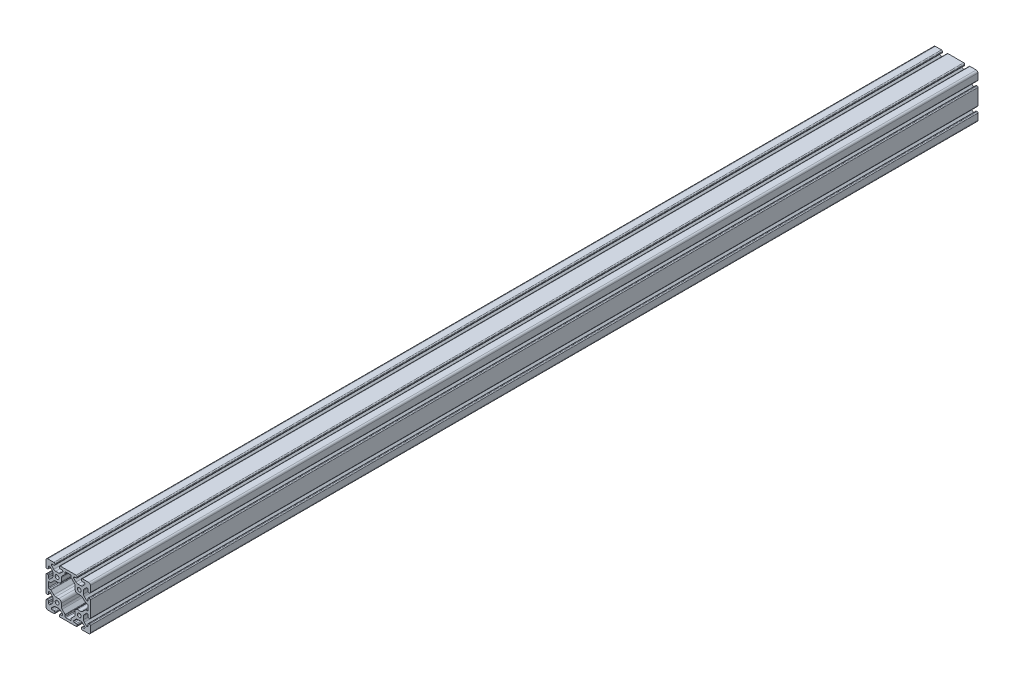
from build123d import *

# Parameters (mm, degrees)
SKETCH1_R      = 3.4
EXTRUDE1_DEPTH = 1600


with BuildPart() as part:
    # Sketch1 → Extrude1 (new body)
    with BuildSketch(Plane.XY):
        with BuildLine():
            Line((29.091242789, 26.036541495), (33.082657296, 30.027956002))
            ThreePointArc((33.082657296, 30.027956002), (33.329219041, 30.192703293), (33.62005845, 30.250554848))
            Line((33.62005845, 30.250554848), (33.955571436, 30.250554848))
            ThreePointArc((33.955571436, 30.250554848), (35.065729082, 29.790712494), (35.525571436, 28.680554848))
            Line((35.525571436, 28.680554848), (35.525571436, 25.777866899))
            ThreePointArc((35.525571436, 25.777866899), (35.985413789, 24.667709253), (37.095571436, 24.207866899))
            Line((37.095571436, 24.207866899), (38.43, 24.207866899))
            ThreePointArc((38.43, 24.207866899), (39.540157646, 24.667709253), (40, 25.777866899))
            Line((40, 25.777866899), (40, 32.933852749))
            Line((40, 32.933852749), (40, 36.83))
            ThreePointArc((40, 36.83), (39.071528496, 39.071528496), (36.83, 40))
            Line((36.83, 40), (25.540851266, 40))
            ThreePointArc((25.540851266, 40), (24.43069362, 39.540157646), (23.970851266, 38.43))
            Line((23.970851266, 38.43), (23.970851266, 37.249043598))
            ThreePointArc((23.970851266, 37.249043598), (24.43069362, 36.138885952), (25.540851266, 35.679043598))
            Line((25.540851266, 35.679043598), (28.625762638, 35.679043598))
            ThreePointArc((28.625762638, 35.679043598), (29.77116849, 35.239363487), (30.250554848, 34.11))
            Line((30.250554848, 34.11), (30.250554848, 33.62005845))
            ThreePointArc((30.250554848, 33.62005845), (30.192703293, 33.329219041), (30.027956002, 33.082657296))
            Line((30.027956002, 33.082657296), (26.036541495, 29.091242789))
            ThreePointArc((26.036541495, 29.091242789), (24.495530588, 28.061572221), (22.677784284, 27.7))
            Line((22.677784284, 27.7), (17.322215716, 27.7))
            ThreePointArc((17.322215716, 27.7), (15.504469412, 28.061572221), (13.963458505, 29.091242789))
            Line((13.963458505, 29.091242789), (9.90393336, 33.150767934))
            ThreePointArc((9.90393336, 33.150767934), (9.764102181, 33.360040084), (9.715, 33.606893415))
            Line((9.715, 33.606893415), (9.715, 34.096834965))
            ThreePointArc((9.715, 34.096834965), (10.178698303, 35.216301697), (11.298165035, 35.68))
            Line((11.298165035, 35.68), (14.642754087, 35.68))
            ThreePointArc((14.642754087, 35.68), (15.560045469, 36.059954531), (15.94, 36.977245913))
            Line((15.94, 36.977245913), (15.94, 38.194841282))
            ThreePointArc((15.94, 38.194841282), (15.411281253, 39.471281253), (14.134841282, 40))
            Line((14.134841282, 40), (6.984433948, 40))
            Line((6.984433948, 40), (-6.984433948, 40))
            Line((-6.984433948, 40), (-14.134841282, 40))
            ThreePointArc((-14.134841282, 40), (-15.411281253, 39.471281253), (-15.94, 38.194841282))
            Line((-15.94, 38.194841282), (-15.94, 36.977245913))
            ThreePointArc((-15.94, 36.977245913), (-15.560045469, 36.059954531), (-14.642754087, 35.68))
            Line((-14.642754087, 35.68), (-11.298165035, 35.68))
            ThreePointArc((-11.298165035, 35.68), (-10.178698303, 35.216301697), (-9.715, 34.096834965))
            Line((-9.715, 34.096834965), (-9.715, 33.606893415))
            ThreePointArc((-9.715, 33.606893415), (-9.764102181, 33.360040084), (-9.90393336, 33.150767934))
            Line((-9.90393336, 33.150767934), (-13.963458505, 29.091242789))
            ThreePointArc((-13.963458505, 29.091242789), (-15.504469412, 28.061572221), (-17.322215716, 27.7))
            Line((-17.322215716, 27.7), (-22.677784284, 27.7))
            ThreePointArc((-22.677784284, 27.7), (-24.495530588, 28.061572221), (-26.036541495, 29.091242789))
            Line((-26.036541495, 29.091242789), (-30.09606664, 33.150767934))
            ThreePointArc((-30.09606664, 33.150767934), (-30.235897819, 33.360040084), (-30.285, 33.606893415))
            Line((-30.285, 33.606893415), (-30.285, 34.096834965))
            ThreePointArc((-30.285, 34.096834965), (-29.821301697, 35.216301697), (-28.701834965, 35.68))
            Line((-28.701834965, 35.68), (-25.357245913, 35.68))
            ThreePointArc((-25.357245913, 35.68), (-24.439954531, 36.059954531), (-24.06, 36.977245913))
            Line((-24.06, 36.977245913), (-24.06, 38.194841282))
            ThreePointArc((-24.06, 38.194841282), (-24.588718747, 39.471281253), (-25.865158718, 40))
            Line((-25.865158718, 40), (-33.031395847, 40))
            Line((-33.031395847, 40), (-36.83, 40))
            ThreePointArc((-36.83, 40), (-39.071528496, 39.071528496), (-40, 36.83))
            Line((-40, 36.83), (-40, 33.318079463))
            Line((-40, 33.318079463), (-40, 25.865158718))
            ThreePointArc((-40, 25.865158718), (-39.471281253, 24.588718747), (-38.194841282, 24.06))
            Line((-38.194841282, 24.06), (-36.977245913, 24.06))
            ThreePointArc((-36.977245913, 24.06), (-36.059954531, 24.439954531), (-35.68, 25.357245913))
            Line((-35.68, 25.357245913), (-35.68, 28.680554848))
            ThreePointArc((-35.68, 28.680554848), (-35.220157646, 29.790712494), (-34.11, 30.250554848))
            Line((-34.11, 30.250554848), (-33.62005845, 30.250554848))
            ThreePointArc((-33.62005845, 30.250554848), (-33.329219041, 30.192703293), (-33.082657296, 30.027956002))
            Line((-33.082657296, 30.027956002), (-29.091242789, 26.036541495))
            ThreePointArc((-29.091242789, 26.036541495), (-28.061572221, 24.495530588), (-27.7, 22.677784284))
            Line((-27.7, 22.677784284), (-27.7, 17.322215716))
            ThreePointArc((-27.7, 17.322215716), (-28.061572221, 15.504469412), (-29.091242789, 13.963458505))
            Line((-29.091242789, 13.963458505), (-33.082657296, 9.972043998))
            ThreePointArc((-33.082657296, 9.972043998), (-33.329219041, 9.807296707), (-33.62005845, 9.749445152))
            Line((-33.62005845, 9.749445152), (-34.11, 9.749445152))
            ThreePointArc((-34.11, 9.749445152), (-35.220157646, 10.209287506), (-35.68, 11.319445152))
            Line((-35.68, 11.319445152), (-35.68, 14.642754087))
            ThreePointArc((-35.68, 14.642754087), (-36.059954531, 15.560045469), (-36.977245913, 15.94))
            Line((-36.977245913, 15.94), (-38.194841282, 15.94))
            ThreePointArc((-38.194841282, 15.94), (-39.471281253, 15.411281253), (-40, 14.134841282))
            Line((-40, 14.134841282), (-40, 7.016888977))
            Line((-40, 7.016888977), (-40, -7.016888977))
            Line((-40, -7.016888977), (-40, -14.447338303))
            ThreePointArc((-40, -14.447338303), (-39.540157646, -15.557495949), (-38.43, -16.017338303))
            Line((-38.43, -16.017338303), (-37.25, -16.017338303))
            ThreePointArc((-37.25, -16.017338303), (-36.139842354, -15.557495949), (-35.68, -14.447338303))
            Line((-35.68, -14.447338303), (-35.68, -11.319445152))
            ThreePointArc((-35.68, -11.319445152), (-35.220157646, -10.209287506), (-34.11, -9.749445152))
            Line((-34.11, -9.749445152), (-33.62005845, -9.749445152))
            ThreePointArc((-33.62005845, -9.749445152), (-33.329219041, -9.807296707), (-33.082657296, -9.972043998))
            Line((-33.082657296, -9.972043998), (-29.091242789, -13.963458505))
            ThreePointArc((-29.091242789, -13.963458505), (-28.061572221, -15.504469412), (-27.7, -17.322215716))
            Line((-27.7, -17.322215716), (-27.7, -22.677784284))
            ThreePointArc((-27.7, -22.677784284), (-28.061572221, -24.495530588), (-29.091242789, -26.036541495))
            Line((-29.091242789, -26.036541495), (-32.871776968, -29.817075674))
            ThreePointArc((-32.871776968, -29.817075674), (-33.10612883, -29.976640176), (-33.382654504, -30.039211548))
            Line((-33.382654504, -30.039211548), (-34.05520779, -30.062697627))
            ThreePointArc((-34.05520779, -30.062697627), (-35.200613642, -29.623017515), (-35.68, -28.493654028))
            Line((-35.68, -28.493654028), (-35.68, -25.59096608))
            ThreePointArc((-35.68, -25.59096608), (-36.139842354, -24.480808433), (-37.25, -24.02096608))
            Line((-37.25, -24.02096608), (-38.43, -24.02096608))
            ThreePointArc((-38.43, -24.02096608), (-39.540157646, -24.480808433), (-40, -25.59096608))
            Line((-40, -25.59096608), (-40, -33.019082273))
            Line((-40, -33.019082273), (-40, -36.83))
            ThreePointArc((-40, -36.83), (-39.071528496, -39.071528496), (-36.83, -40))
            Line((-36.83, -40), (-33, -40))
            Line((-33, -40), (-25.72307469, -40))
            ThreePointArc((-25.72307469, -40), (-24.612917043, -39.540157646), (-24.15307469, -38.43))
            Line((-24.15307469, -38.43), (-24.15307469, -37.25))
            ThreePointArc((-24.15307469, -37.25), (-24.612917043, -36.139842354), (-25.72307469, -35.68))
            Line((-25.72307469, -35.68), (-28.680554848, -35.68))
            ThreePointArc((-28.680554848, -35.68), (-29.790712494, -35.220157646), (-30.250554848, -34.11))
            Line((-30.250554848, -34.11), (-30.250554848, -33.62005845))
            ThreePointArc((-30.250554848, -33.62005845), (-30.192703293, -33.329219041), (-30.027956002, -33.082657296))
            Line((-30.027956002, -33.082657296), (-26.036541495, -29.091242789))
            ThreePointArc((-26.036541495, -29.091242789), (-24.495530588, -28.061572221), (-22.677784284, -27.7))
            Line((-22.677784284, -27.7), (-17.322215716, -27.7))
            ThreePointArc((-17.322215716, -27.7), (-15.504469412, -28.061572221), (-13.963458505, -29.091242789))
            Line((-13.963458505, -29.091242789), (-10.203784275, -32.85091702))
            ThreePointArc((-10.203784275, -32.85091702), (-10.044219772, -33.085268882), (-9.9816484, -33.361794556))
            Line((-9.9816484, -33.361794556), (-9.957433876, -34.05520779))
            ThreePointArc((-9.957433876, -34.05520779), (-10.397113988, -35.200613642), (-11.526477474, -35.68))
            Line((-11.526477474, -35.68), (-14.429165423, -35.68))
            ThreePointArc((-14.429165423, -35.68), (-15.539323069, -36.139842354), (-15.999165423, -37.25))
            Line((-15.999165423, -37.25), (-15.999165423, -38.43))
            ThreePointArc((-15.999165423, -38.43), (-15.539323069, -39.540157646), (-14.429165423, -40))
            Line((-14.429165423, -40), (-6.998716097, -40))
            Line((-6.998716097, -40), (6.998716097, -40))
            Line((6.998716097, -40), (14.424638994, -40))
            ThreePointArc((14.424638994, -40), (15.53479664, -39.540157646), (15.994638994, -38.43))
            Line((15.994638994, -38.43), (15.994638994, -37.032644306))
            ThreePointArc((15.994638994, -37.032644306), (15.53479664, -35.922486659), (14.424638994, -35.462644306))
            Line((14.424638994, -35.462644306), (11.382372282, -35.462644306))
            ThreePointArc((11.382372282, -35.462644306), (10.272214636, -35.002801952), (9.812372282, -33.892644306))
            Line((9.812372282, -33.892644306), (9.812372282, -33.55713132))
            ThreePointArc((9.812372282, -33.55713132), (9.870223837, -33.266291912), (10.034971128, -33.019730166))
            Line((10.034971128, -33.019730166), (13.963458505, -29.091242789))
            ThreePointArc((13.963458505, -29.091242789), (15.504469412, -28.061572221), (17.322215716, -27.7))
            Line((17.322215716, -27.7), (22.677784284, -27.7))
            ThreePointArc((22.677784284, -27.7), (24.495530588, -28.061572221), (26.036541495, -29.091242789))
            Line((26.036541495, -29.091242789), (29.794925243, -32.849626538))
            ThreePointArc((29.794925243, -32.849626538), (29.954489746, -33.083978399), (30.017061118, -33.360504074))
            Line((30.017061118, -33.360504074), (30.041320706, -34.05520779))
            ThreePointArc((30.041320706, -34.05520779), (29.601640594, -35.200613642), (28.472277108, -35.68))
            Line((28.472277108, -35.68), (25.569589159, -35.68))
            ThreePointArc((25.569589159, -35.68), (24.459431513, -36.139842354), (23.999589159, -37.25))
            Line((23.999589159, -37.25), (23.999589159, -38.43))
            ThreePointArc((23.999589159, -38.43), (24.459431513, -39.540157646), (25.569589159, -40))
            Line((25.569589159, -40), (32.999849358, -40))
            Line((32.999849358, -40), (36.83, -40))
            ThreePointArc((36.83, -40), (39.071528496, -39.071528496), (40, -36.83))
            Line((40, -36.83), (40, -33.025941835))
            Line((40, -33.025941835), (40, -25.777866899))
            ThreePointArc((40, -25.777866899), (39.540157646, -24.667709253), (38.43, -24.207866899))
            Line((38.43, -24.207866899), (37.25, -24.207866899))
            ThreePointArc((37.25, -24.207866899), (36.139842354, -24.667709253), (35.68, -25.777866899))
            Line((35.68, -25.777866899), (35.68, -28.680554848))
            ThreePointArc((35.68, -28.680554848), (35.220157646, -29.790712494), (34.11, -30.250554848))
            Line((34.11, -30.250554848), (33.62005845, -30.250554848))
            ThreePointArc((33.62005845, -30.250554848), (33.329219041, -30.192703293), (33.082657296, -30.027956002))
            Line((33.082657296, -30.027956002), (29.091242789, -26.036541495))
            ThreePointArc((29.091242789, -26.036541495), (28.061572221, -24.495530588), (27.7, -22.677784284))
            Line((27.7, -22.677784284), (27.7, -17.322215716))
            ThreePointArc((27.7, -17.322215716), (28.061572221, -15.504469412), (29.091242789, -13.963458505))
            Line((29.091242789, -13.963458505), (33.082657296, -9.972043998))
            ThreePointArc((33.082657296, -9.972043998), (33.329219041, -9.807296707), (33.62005845, -9.749445152))
            Line((33.62005845, -9.749445152), (34.11, -9.749445152))
            ThreePointArc((34.11, -9.749445152), (35.220157646, -10.209287506), (35.68, -11.319445152))
            Line((35.68, -11.319445152), (35.68, -14.222133101))
            ThreePointArc((35.68, -14.222133101), (36.139842354, -15.332290747), (37.25, -15.792133101))
            Line((37.25, -15.792133101), (38.43, -15.792133101))
            ThreePointArc((38.43, -15.792133101), (39.540157646, -15.332290747), (40, -14.222133101))
            Line((40, -14.222133101), (40, -7.021415406))
            Line((40, -7.021415406), (40, 7.021415406))
            Line((40, 7.021415406), (40, 14.222133101))
            ThreePointArc((40, 14.222133101), (39.540157646, 15.332290747), (38.43, 15.792133101))
            Line((38.43, 15.792133101), (37.25, 15.792133101))
            ThreePointArc((37.25, 15.792133101), (36.139842354, 15.332290747), (35.68, 14.222133101))
            Line((35.68, 14.222133101), (35.68, 11.319445152))
            ThreePointArc((35.68, 11.319445152), (35.220157646, 10.209287506), (34.11, 9.749445152))
            Line((34.11, 9.749445152), (33.62005845, 9.749445152))
            ThreePointArc((33.62005845, 9.749445152), (33.329219041, 9.807296707), (33.082657296, 9.972043998))
            Line((33.082657296, 9.972043998), (29.091242789, 13.963458505))
            ThreePointArc((29.091242789, 13.963458505), (28.061572221, 15.504469412), (27.7, 17.322215716))
            Line((27.7, 17.322215716), (27.7, 22.677784284))
            ThreePointArc((27.7, 22.677784284), (28.061572221, 24.495530588), (29.091242789, 26.036541495))
        make_face()
        with Locations((-20, 20)):
            Circle(SKETCH1_R, mode=Mode.SUBTRACT)
        with Locations((20, 20)):
            Circle(SKETCH1_R, mode=Mode.SUBTRACT)
        with Locations((20, -20)):
            Circle(SKETCH1_R, mode=Mode.SUBTRACT)
        with Locations((-20, -20)):
            Circle(SKETCH1_R, mode=Mode.SUBTRACT)
        with BuildLine():
            Line((17.07, 12.32), (22.657784284, 12.32))
            ThreePointArc((22.657784284, 12.32), (24.475530588, 11.958427779), (26.016541495, 10.928757211))
            Line((26.016541495, 10.928757211), (31.143879165, 5.80141954))
            ThreePointArc((31.143879165, 5.80141954), (31.555896818, 5.526118146), (32.041904777, 5.429445152))
            Line((32.041904777, 5.429445152), (34.41, 5.429445152))
            ThreePointArc((34.41, 5.429445152), (35.308025612, 5.057470764), (35.68, 4.159445152))
            Line((35.68, 4.159445152), (35.68, -4.159445152))
            ThreePointArc((35.68, -4.159445152), (35.308025612, -5.057470764), (34.41, -5.429445152))
            Line((34.41, -5.429445152), (32.041904777, -5.429445152))
            ThreePointArc((32.041904777, -5.429445152), (31.555896818, -5.526118146), (31.143879165, -5.80141954))
            Line((31.143879165, -5.80141954), (26.016541495, -10.928757211))
            ThreePointArc((26.016541495, -10.928757211), (24.475530588, -11.958427779), (22.657784284, -12.32))
            Line((22.657784284, -12.32), (17.07, -12.32))
            ThreePointArc((17.07, -12.32), (13.711242789, -13.711242789), (12.32, -17.07))
            Line((12.32, -17.07), (12.32, -22.657784284))
            ThreePointArc((12.32, -22.657784284), (11.958427779, -24.475530588), (10.928757211, -26.016541495))
            Line((10.928757211, -26.016541495), (5.80141954, -31.143879165))
            ThreePointArc((5.80141954, -31.143879165), (5.526118146, -31.555896818), (5.429445152, -32.041904777))
            Line((5.429445152, -32.041904777), (5.429445152, -34.41))
            ThreePointArc((5.429445152, -34.41), (5.057470764, -35.308025612), (4.159445152, -35.68))
            Line((4.159445152, -35.68), (-4.159445152, -35.68))
            ThreePointArc((-4.159445152, -35.68), (-5.057470764, -35.308025612), (-5.429445152, -34.41))
            Line((-5.429445152, -34.41), (-5.429445152, -32.041904777))
            ThreePointArc((-5.429445152, -32.041904777), (-5.526118146, -31.555896818), (-5.80141954, -31.143879165))
            Line((-5.80141954, -31.143879165), (-10.928757211, -26.016541495))
            ThreePointArc((-10.928757211, -26.016541495), (-11.958427779, -24.475530588), (-12.32, -22.657784284))
            Line((-12.32, -22.657784284), (-12.32, -17.07))
            ThreePointArc((-12.32, -17.07), (-13.711242789, -13.711242789), (-17.07, -12.32))
            Line((-17.07, -12.32), (-22.657784284, -12.32))
            ThreePointArc((-22.657784284, -12.32), (-24.475530588, -11.958427779), (-26.016541495, -10.928757211))
            Line((-26.016541495, -10.928757211), (-31.143879165, -5.80141954))
            ThreePointArc((-31.143879165, -5.80141954), (-31.555896818, -5.526118146), (-32.041904777, -5.429445152))
            Line((-32.041904777, -5.429445152), (-34.41, -5.429445152))
            ThreePointArc((-34.41, -5.429445152), (-35.308025612, -5.057470764), (-35.68, -4.159445152))
            Line((-35.68, -4.159445152), (-35.68, 4.159445152))
            ThreePointArc((-35.68, 4.159445152), (-35.308025612, 5.057470764), (-34.41, 5.429445152))
            Line((-34.41, 5.429445152), (-32.041904777, 5.429445152))
            ThreePointArc((-32.041904777, 5.429445152), (-31.555896818, 5.526118146), (-31.143879165, 5.80141954))
            Line((-31.143879165, 5.80141954), (-26.016541495, 10.928757211))
            ThreePointArc((-26.016541495, 10.928757211), (-24.475530588, 11.958427779), (-22.657784284, 12.32))
            Line((-22.657784284, 12.32), (-17.07, 12.32))
            ThreePointArc((-17.07, 12.32), (-13.711242789, 13.711242789), (-12.32, 17.07))
            Line((-12.32, 17.07), (-12.32, 22.657784284))
            ThreePointArc((-12.32, 22.657784284), (-11.958427779, 24.475530588), (-10.928757211, 26.016541495))
            Line((-10.928757211, 26.016541495), (-5.80141954, 31.143879165))
            ThreePointArc((-5.80141954, 31.143879165), (-5.526118146, 31.555896818), (-5.429445152, 32.041904777))
            Line((-5.429445152, 32.041904777), (-5.429445152, 34.41))
            ThreePointArc((-5.429445152, 34.41), (-5.057470764, 35.308025612), (-4.159445152, 35.68))
            Line((-4.159445152, 35.68), (4.159445152, 35.68))
            ThreePointArc((4.159445152, 35.68), (5.057470764, 35.308025612), (5.429445152, 34.41))
            Line((5.429445152, 34.41), (5.429445152, 32.041904777))
            ThreePointArc((5.429445152, 32.041904777), (5.526118146, 31.555896818), (5.80141954, 31.143879165))
            Line((5.80141954, 31.143879165), (10.928757211, 26.016541495))
            ThreePointArc((10.928757211, 26.016541495), (11.958427779, 24.475530588), (12.32, 22.657784284))
            Line((12.32, 22.657784284), (12.32, 17.07))
            ThreePointArc((12.32, 17.07), (13.711242789, 13.711242789), (17.07, 12.32))
        make_face(mode=Mode.SUBTRACT)
    extrude(amount=-EXTRUDE1_DEPTH)


solid = part.part
